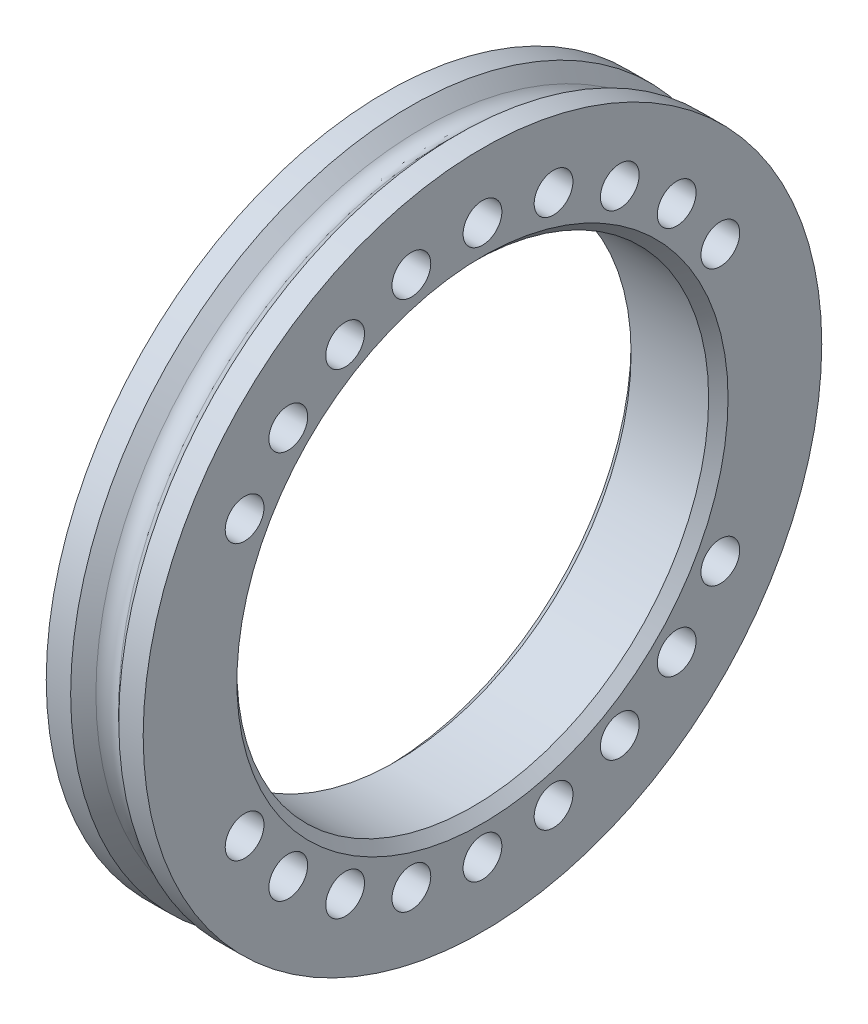
from build123d import *

# Parameters (mm, degrees)
CHAMFER1_SIZE                   = 3
FILLET3_R                       = 5
SKETCH3_R                       = 6
CUT_EXTRUDE3_DEPTH              = 152.492574214
CIRPATTERN2_COUNT               = 5
CIRPATTERN2_ANGLE               = 60
CIRPATTERN2_THE_OTHER_WAY_COUNT = 5
CIRPATTERN2_THE_OTHER_WAY_ANGLE = 60
MIRROR1_COPY_1_SKETCH_R         = 6
MIRROR1_COPY_1_DEPTH            = 152.492574214
MIRROR1_COPY_2_SKETCH_R         = 6
MIRROR1_COPY_2_DEPTH            = 152.492574214
MIRROR1_COPY_3_SKETCH_R         = 6
MIRROR1_COPY_3_DEPTH            = 152.492574214
MIRROR1_COPY_4_SKETCH_R         = 6
MIRROR1_COPY_4_DEPTH            = 152.492574214
MIRROR1_COPY_5_SKETCH_R         = 6
MIRROR1_COPY_5_DEPTH            = 152.492574214
MIRROR1_COPY_6_SKETCH_R         = 6
MIRROR1_COPY_6_DEPTH            = 152.492574214
MIRROR1_COPY_7_SKETCH_R         = 6
MIRROR1_COPY_7_DEPTH            = 152.492574214
MIRROR1_COPY_8_SKETCH_R         = 6
MIRROR1_COPY_8_DEPTH            = 152.492574214


with BuildPart() as part:
    # Sketch1 → Revolve1 (revolve)
    with BuildSketch(Plane.XY, mode=Mode.PRIVATE) as revolve1_sk:
        Polygon((15, 105), (7.442388155, 105), (0, 97.557611845), (-7.442388155, 105), (-15, 105), (-15, 73), (15, 73), align=None)
    revolve(revolve1_sk.sketch.rotate(Axis((0, 0, 0), (1, 0, 0)), 90), axis=Axis((0, 0, 0), (1, 0, 0)))

    # Chamfer1
    chamfer1_edges = [part.edges().sort_by_distance(p)[0] for p in [
        (15, 0, -73),
        (-15, 0, -73),
    ]]
    chamfer(chamfer1_edges, length=CHAMFER1_SIZE)

    # Fillet3
    fillet3_edges = [part.edges().sort_by_distance(p)[0] for p in [
        (0, 0, -97.557611845),
    ]]
    fillet(fillet3_edges, radius=FILLET3_R)

    # Sketch3 → Cut-Extrude3 (cut, through all)
    with BuildSketch(Plane(origin=(15, 0, 0), x_dir=(0, 0, -1), z_dir=(1, 0, 0))):
        with Locations((0, 85)):
            Circle(SKETCH3_R)
    cut_extrude3 = extrude(amount=-CUT_EXTRUDE3_DEPTH, mode=Mode.SUBTRACT)

    # CirPattern2: Cut-Extrude3 ×5 about axis
    cirpattern2_axis = Axis((0, 0, 0), (-1, 0, 0))
    for i in range(1, CIRPATTERN2_COUNT):
        add(cut_extrude3.rotate(cirpattern2_axis, i * CIRPATTERN2_ANGLE / (CIRPATTERN2_COUNT - 1)), mode=Mode.SUBTRACT)

    # CirPattern2 the other way: Cut-Extrude3 ×5 about axis
    cirpattern2_the_other_way_axis = Axis((0, 0, 0), (1, 0, 0))
    for i in range(1, CIRPATTERN2_THE_OTHER_WAY_COUNT):
        add(cut_extrude3.rotate(cirpattern2_the_other_way_axis, i * CIRPATTERN2_THE_OTHER_WAY_ANGLE / (CIRPATTERN2_THE_OTHER_WAY_COUNT - 1)), mode=Mode.SUBTRACT)

    # Mirror1: Cut-Extrude3 across plane
    add(cut_extrude3.mirror(Plane.ZX), mode=Mode.SUBTRACT)

    # Mirror1 copy 1 sketch → Mirror1 copy 1 (cut, through all)
    with BuildSketch(Plane(origin=(15, 0, 0), x_dir=(0, 0.2588190451025214, -0.9659258262890681), z_dir=(1, 0, 0))):
        with Locations((0, -85)):
            Circle(MIRROR1_COPY_1_SKETCH_R)
    extrude(amount=-MIRROR1_COPY_1_DEPTH, mode=Mode.SUBTRACT)

    # Mirror1 copy 2 sketch → Mirror1 copy 2 (cut, through all)
    with BuildSketch(Plane(origin=(15, 0, 0), x_dir=(0, 0.5000000000000011, -0.866025403784438), z_dir=(1, 0, 0))):
        with Locations((0, -85)):
            Circle(MIRROR1_COPY_2_SKETCH_R)
    extrude(amount=-MIRROR1_COPY_2_DEPTH, mode=Mode.SUBTRACT)

    # Mirror1 copy 3 sketch → Mirror1 copy 3 (cut, through all)
    with BuildSketch(Plane(origin=(15, 0, 0), x_dir=(0, 0.7071067811865488, -0.7071067811865462), z_dir=(1, 0, 0))):
        with Locations((0, -85)):
            Circle(MIRROR1_COPY_3_SKETCH_R)
    extrude(amount=-MIRROR1_COPY_3_DEPTH, mode=Mode.SUBTRACT)

    # Mirror1 copy 4 sketch → Mirror1 copy 4 (cut, through all)
    with BuildSketch(Plane(origin=(15, 0, 0), x_dir=(0, 0.8660254037844399, -0.4999999999999978), z_dir=(1, 0, 0))):
        with Locations((0, -85)):
            Circle(MIRROR1_COPY_4_SKETCH_R)
    extrude(amount=-MIRROR1_COPY_4_DEPTH, mode=Mode.SUBTRACT)

    # Mirror1 copy 5 sketch → Mirror1 copy 5 (cut, through all)
    with BuildSketch(Plane(origin=(15, 0, 0), x_dir=(0, -0.2588190451025214, -0.9659258262890681), z_dir=(1, 0, 0))):
        with Locations((0, -85)):
            Circle(MIRROR1_COPY_5_SKETCH_R)
    extrude(amount=-MIRROR1_COPY_5_DEPTH, mode=Mode.SUBTRACT)

    # Mirror1 copy 6 sketch → Mirror1 copy 6 (cut, through all)
    with BuildSketch(Plane(origin=(15, 0, 0), x_dir=(0, -0.5000000000000011, -0.866025403784438), z_dir=(1, 0, 0))):
        with Locations((0, -85)):
            Circle(MIRROR1_COPY_6_SKETCH_R)
    extrude(amount=-MIRROR1_COPY_6_DEPTH, mode=Mode.SUBTRACT)

    # Mirror1 copy 7 sketch → Mirror1 copy 7 (cut, through all)
    with BuildSketch(Plane(origin=(15, 0, 0), x_dir=(0, -0.7071067811865488, -0.7071067811865462), z_dir=(1, 0, 0))):
        with Locations((0, -85)):
            Circle(MIRROR1_COPY_7_SKETCH_R)
    extrude(amount=-MIRROR1_COPY_7_DEPTH, mode=Mode.SUBTRACT)

    # Mirror1 copy 8 sketch → Mirror1 copy 8 (cut, through all)
    with BuildSketch(Plane(origin=(15, 0, 0), x_dir=(0, -0.8660254037844399, -0.4999999999999978), z_dir=(1, 0, 0))):
        with Locations((0, -85)):
            Circle(MIRROR1_COPY_8_SKETCH_R)
    extrude(amount=-MIRROR1_COPY_8_DEPTH, mode=Mode.SUBTRACT)


solid = part.part
